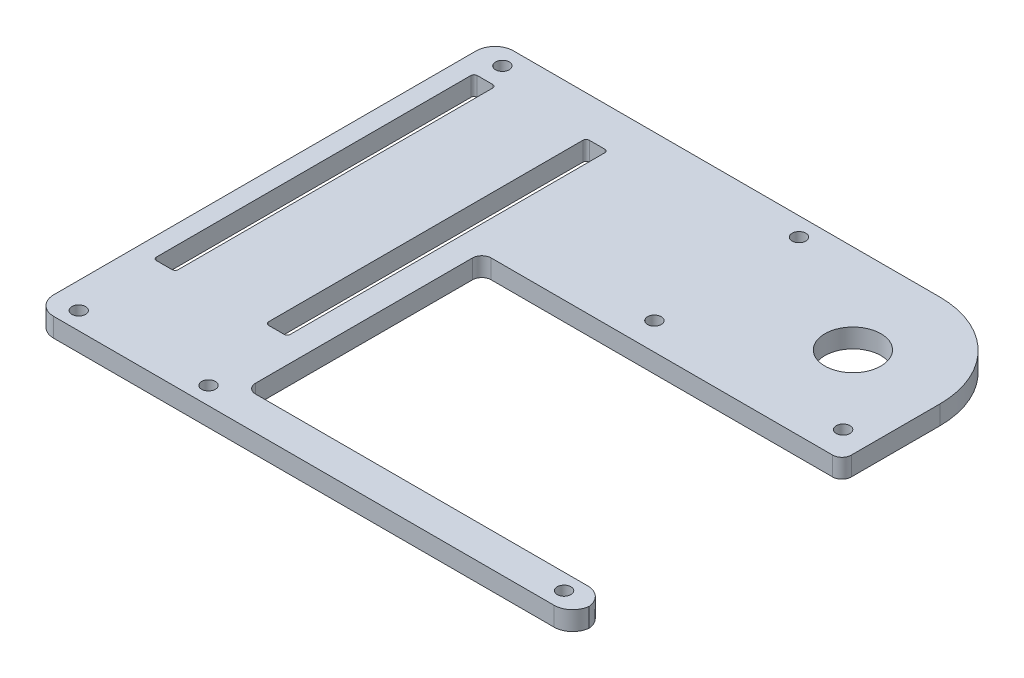
from build123d import *

# Parameters (mm, degrees)
SKETCH2_R           = 1.1
SKETCH2_R_2         = 4.5
BOSS_EXTRUDE1_DEPTH = 3.048


with BuildPart() as part:
    # Sketch2 → Boss-Extrude1 (new body)
    with BuildSketch(Plane(origin=(0, 0, 0), x_dir=(1, 0, 0), z_dir=(0, 1, 0))):
        with BuildLine():
            Line((28.5, -66.94), (28.5, -32.09))
            ThreePointArc((28.5, -32.09), (28.939339828, -31.029339828), (30, -30.59))
            Line((30, -30.59), (84.83, -30.59))
            ThreePointArc((84.83, -30.59), (85.890660172, -30.150660172), (86.33, -29.09))
            Line((86.33, -29.09), (86.33, -14.88))
            ThreePointArc((86.33, -14.88), (81.971748904, -4.358251096), (71.45, 0))
            Line((71.45, 0), (3, 0))
            ThreePointArc((3, 0), (0.878679656, -0.878679656), (0, -3))
            Line((0, -3), (0, -70.84))
            ThreePointArc((0, -70.84), (0.878679656, -72.961320344), (3, -73.84))
            Line((3, -73.84), (83.340051803, -73.84))
            ThreePointArc((83.340051803, -73.84), (85.333792006, -73.081651177), (86.319565186, -71.19))
            ThreePointArc((86.319565186, -71.19), (85.361009601, -69.232059783), (83.33, -68.44))
            Line((83.33, -68.44), (30, -68.44))
            ThreePointArc((30, -68.44), (28.939339828, -68.000660172), (28.5, -66.94))
        make_face()
        with Locations(Location((4.19, -71.01, 0), (0, 0, 90))):
            Circle(SKETCH2_R, mode=Mode.SUBTRACT)
        with Locations(Location((25.03, -71.01, 0), (0, 0, 90))):
            Circle(SKETCH2_R, mode=Mode.SUBTRACT)
        with Locations(Location((4.19, -2.98, 0), (0, 0, 90))):
            Circle(SKETCH2_R, mode=Mode.SUBTRACT)
        with Locations(Location((51.82, -2.98, 0), (0, 0, 90))):
            Circle(SKETCH2_R, mode=Mode.SUBTRACT)
        with Locations(Location((51.82, -26.2, 0), (0, 0, 90))):
            Circle(SKETCH2_R, mode=Mode.SUBTRACT)
        with Locations(Location((82.13, -71.01, 0), (0, 0, 90))):
            Circle(SKETCH2_R, mode=Mode.SUBTRACT)
        with Locations(Location((82.13, -26.2, 0), (0, 0, 90))):
            Circle(SKETCH2_R, mode=Mode.SUBTRACT)
        with Locations(Location((71.83, -14.33, 0), (0, 0, 90))):
            Circle(SKETCH2_R_2, mode=Mode.SUBTRACT)
        with BuildLine():
            Line((6.5, -6.84), (6.5, -57.34))
            ThreePointArc((6.5, -57.34), (6.353553391, -57.693553391), (6, -57.84))
            Line((6, -57.84), (3.5, -57.84))
            ThreePointArc((3.5, -57.84), (3.146446609, -57.693553391), (3, -57.34))
            Line((3, -57.34), (3, -6.84))
            ThreePointArc((3, -6.84), (3.146446609, -6.486446609), (3.5, -6.34))
            Line((3.5, -6.34), (6, -6.34))
            ThreePointArc((6, -6.34), (6.353553391, -6.486446609), (6.5, -6.84))
        make_face(mode=Mode.SUBTRACT)
        with BuildLine():
            Line((24.5, -6.84), (24.5, -57.34))
            ThreePointArc((24.5, -57.34), (24.353553391, -57.693553391), (24, -57.84))
            Line((24, -57.84), (21.5, -57.84))
            ThreePointArc((21.5, -57.84), (21.146446609, -57.693553391), (21, -57.34))
            Line((21, -57.34), (21, -6.84))
            ThreePointArc((21, -6.84), (21.146446609, -6.486446609), (21.5, -6.34))
            Line((21.5, -6.34), (24, -6.34))
            ThreePointArc((24, -6.34), (24.353553391, -6.486446609), (24.5, -6.84))
        make_face(mode=Mode.SUBTRACT)
    extrude(amount=BOSS_EXTRUDE1_DEPTH)


solid = part.part
